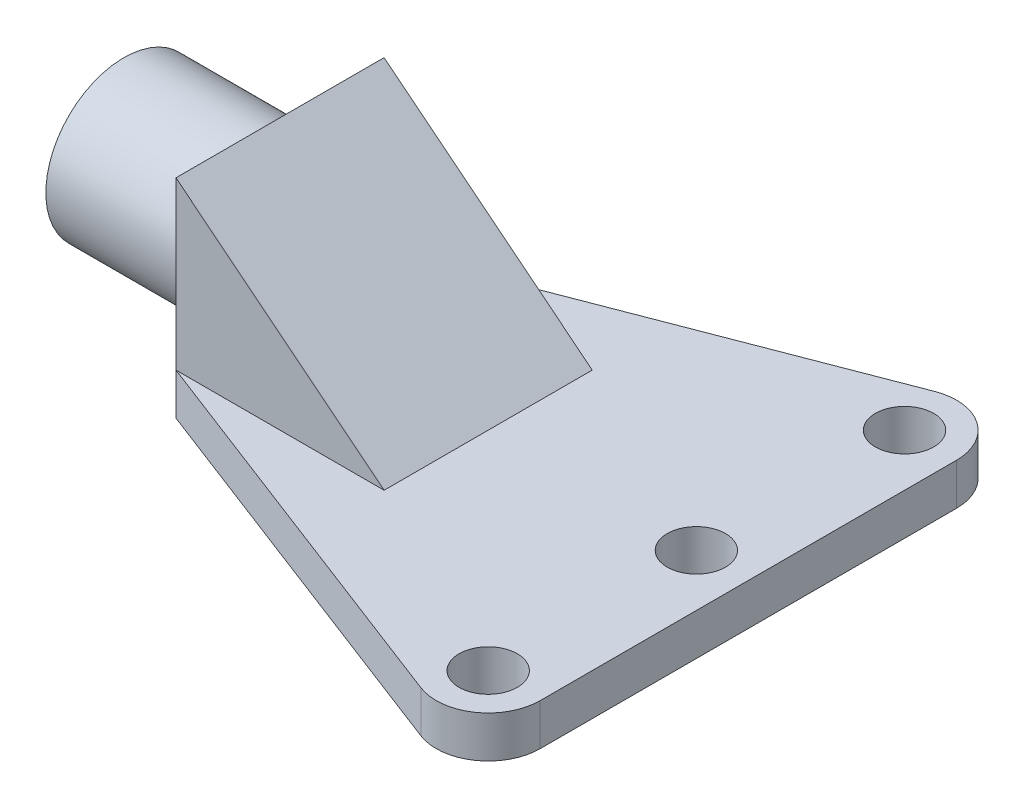
from build123d import *

# Parameters (mm, degrees)
SKETCH2_W           = 25.4
SKETCH2_H           = 25.4
BOSS_EXTRUDE1_DEPTH = 25.4
BOSS_EXTRUDE2_DEPTH = 5.08
SKETCH5_R           = 3.556
CUT_EXTRUDE1_DEPTH  = 5.08
SKETCH6_R           = 3.556
CUT_EXTRUDE2_DEPTH  = 5.08
CUT_EXTRUDE3_DEPTH  = 25.4
SKETCH10_R          = 9.525
BOSS_EXTRUDE3_DEPTH = 19.05
CUT_EXTRUDE4_REACH  = 82.822
SKETCH12_R          = 3.556


with BuildPart() as part:
    # Sketch2 → Boss-Extrude1 (new body)
    with BuildSketch(Plane(origin=(0, 0, 0), x_dir=(1, 0, 0), z_dir=(0, 1, 0))):
        with Locations((-38.1, 0)):
            Rectangle(SKETCH2_W, SKETCH2_H)
    extrude(amount=BOSS_EXTRUDE1_DEPTH)

    # Sketch8 → Cut-Extrude3 (cut)
    with BuildSketch(Plane(origin=(0, 0, -12.7), x_dir=(-1, 0, 0), z_dir=(0, 0, -1))):
        Polygon((50.8, 25.4), (25.4, 5.08), (25.4, 25.4), align=None)
    extrude(amount=-CUT_EXTRUDE3_DEPTH, mode=Mode.SUBTRACT)



with BuildPart() as body_2:
    # Sketch4 → Boss-Extrude2 (new body)
    with BuildSketch(Plane(origin=(0, 0, 0), x_dir=(1, 0, 0), z_dir=(0, 1, 0))):
        with BuildLine():
            Line((-50.8, -12.7), (-2.275658989, -31.327921356))
            ThreePointArc((-2.275658989, -31.327921356), (3.596462869, -30.633003943), (6.349714595, -25.4))
            Line((6.349714595, -25.4), (6.35, 25.4))
            ThreePointArc((6.35, 25.4), (3.596610154, 30.633249029), (-2.275793827, 31.328175306))
            Line((-2.275793827, 31.328175306), (-50.8, 12.7))
            Line((-50.8, 12.7), (-50.8, -12.7))
        make_face()
    extrude(amount=BOSS_EXTRUDE2_DEPTH)

    # Sketch5 → Cut-Extrude1 (cut)
    with BuildSketch(Plane(origin=(0, 0, 0), x_dir=(1, 0, 0), z_dir=(0, 1, 0))):
        with Locations(Location((0, -25.4, 0), (0, 0, 90))):
            Circle(SKETCH5_R)
    extrude(amount=CUT_EXTRUDE1_DEPTH, mode=Mode.SUBTRACT)

    # Sketch6 → Cut-Extrude2 (cut)
    with BuildSketch(Plane(origin=(0, 0, 0), x_dir=(1, 0, 0), z_dir=(0, 1, 0))):
        with Locations(Location((0, 25.4, 0), (0, 0, 90))):
            Circle(SKETCH6_R)
    extrude(amount=CUT_EXTRUDE2_DEPTH, mode=Mode.SUBTRACT)


with BuildPart() as part_1:
    add(part.part)

    add(body_2.part)  # Boss-Extrude3 merges body 2
    # Sketch10 → Boss-Extrude3 (add)
    with BuildSketch(Plane.ZY.offset(50.8)):
        with Locations(Location((0, 12.7, 0), (0, 0, 180))):
            Circle(SKETCH10_R)
    extrude(amount=BOSS_EXTRUDE3_DEPTH)

    # Sketch12 → Cut-Extrude4 (cut, up to next)
    with BuildSketch(Plane(origin=(0, 0, 0), x_dir=(1, 0, 0), z_dir=(0, 1, 0)), mode=Mode.PRIVATE) as cut_extrude4_sk1:
        with Locations(Location((0, 0, 0), (0, 0, 90))):
            Circle(SKETCH12_R)
    cut_extrude4_tool1 = extrude(cut_extrude4_sk1.sketch, amount=CUT_EXTRUDE4_REACH, mode=Mode.PRIVATE) & part_1.part
    add(cut_extrude4_tool1.solids().sort_by_distance((0, 0, 0))[0], mode=Mode.SUBTRACT)


solid = part_1.part
